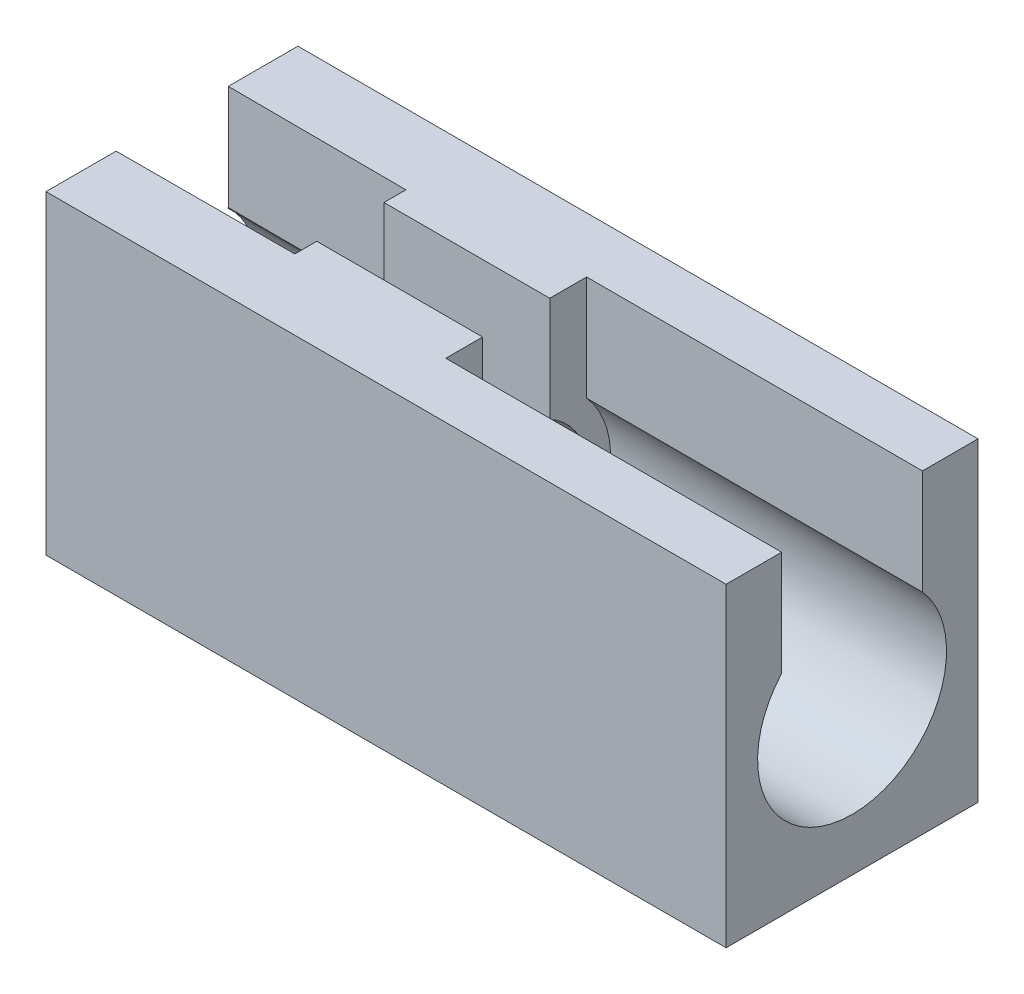
from build123d import *

# Parameters (mm, degrees)
SKETCH_1_W          = 32.4
SKETCH_1_H          = 12
EXTRUDE_1_DEPTH     = 10
SKETCH_4_R          = 4
CUT_EXTRUDE_2_DEPTH = 8.5
SKETCH_7_R          = 3.4
CUT_EXTRUDE_3_DEPTH = 7.9
SKETCH_8_R          = 4.5
CUT_EXTRUDE_4_DEPTH = 16
SKETCH_9_W          = 32.4
SKETCH_9_H          = 2.645898034
EXTRUDE_2_DEPTH     = 5
EXTRUDE_3_DEPTH     = 5
EXTRUDE_4_DEPTH     = 5


with BuildPart() as part:
    # 草圖1 → 填料-伸長1 (new body)
    with BuildSketch(Plane(origin=(0, 0, 0), x_dir=(1, 0, 0), z_dir=(0, 1, 0))):
        Rectangle(SKETCH_1_W, SKETCH_1_H)
    extrude(amount=EXTRUDE_1_DEPTH)

    # 草圖4 → 除料-伸長2 (cut)
    with BuildSketch(Plane.ZY.offset(16.2)):
        with Locations((0, 7)):
            Circle(SKETCH_4_R)
    extrude(amount=-CUT_EXTRUDE_2_DEPTH, mode=Mode.SUBTRACT)

    # 草圖7 → 除料-伸長3 (cut)
    with BuildSketch(Plane.ZY.offset(7.7)):
        with Locations((0, 7)):
            Circle(SKETCH_7_R)
    extrude(amount=-CUT_EXTRUDE_3_DEPTH, mode=Mode.SUBTRACT)

    # 草圖8 → 除料-伸長4 (cut)
    with BuildSketch(Plane(origin=(16.2, 0, 0), x_dir=(0, 0, -1), z_dir=(1, 0, 0))):
        with Locations((0, 7)):
            Circle(SKETCH_8_R)
    extrude(amount=-CUT_EXTRUDE_4_DEPTH, mode=Mode.SUBTRACT)

    # 草圖9 → 填料-伸長2 (add)
    with BuildSketch(Plane(origin=(0, 10, 0), x_dir=(1, 0, 0), z_dir=(0, 1, 0))):
        with Locations((0, 4.677050983)):
            Rectangle(SKETCH_9_W, SKETCH_9_H)
    extrude(amount=EXTRUDE_2_DEPTH)

    # 草圖10 → 填料-伸長3 (add)
    with BuildSketch(Plane(origin=(0, 10, 0), x_dir=(1, 0, 0), z_dir=(0, 1, 0))):
        Polygon((-16.2, 3.372532617), (-16.2, 2.685476071), (-7.7, 2.645751311), (-7.7, 1.6), (0.2, 1.6), (0.2, 3.354101966), align=None)
    extrude(amount=EXTRUDE_3_DEPTH)

    # 草圖11 → 填料-伸長4 (add)
    with BuildSketch(Plane(origin=(0, 10, 0), x_dir=(1, 0, 0), z_dir=(0, 1, 0))):
        Polygon((-16.2, -2.660675208), (-16.2, -6), (16.2, -6), (16.2, -3.354101966), (0.2, -3.354101966), (0.2, -1.6), (-7.7, -1.6), (-7.7, -2.645751311), align=None)
    extrude(amount=EXTRUDE_4_DEPTH)


solid = part.part
